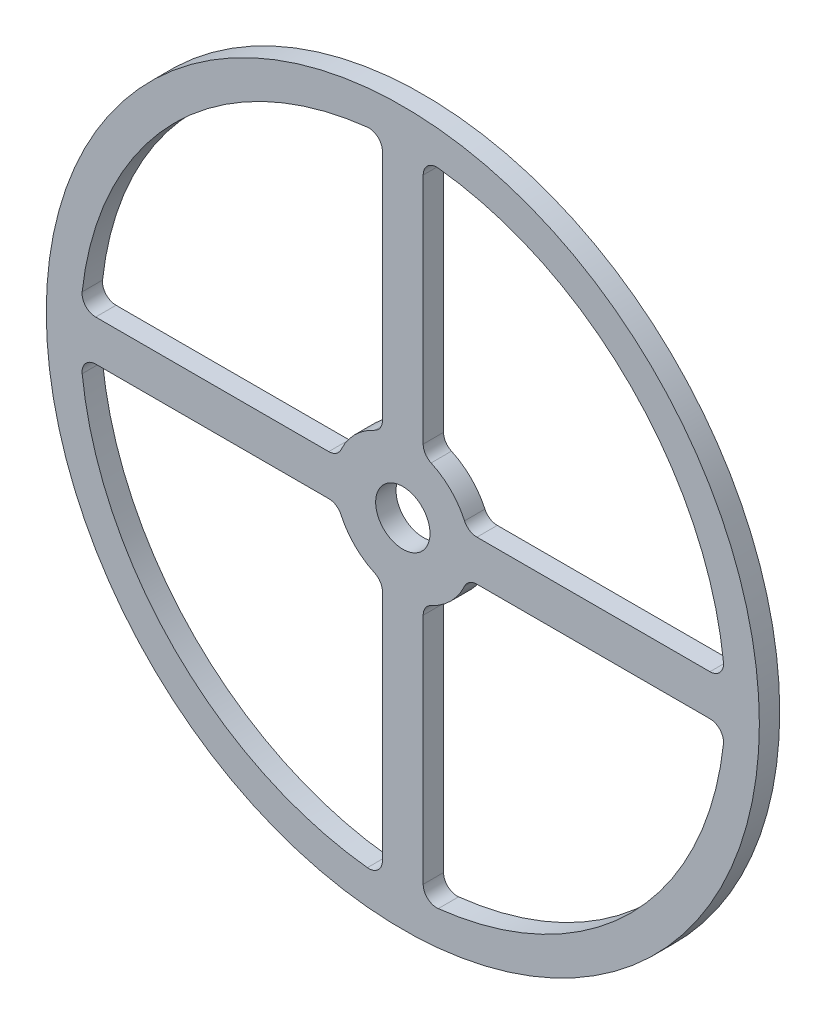
from build123d import *

# Parameters (mm, degrees)
SKETCH_1_R      = 52.5
SKETCH_1_R_2    = 4
EXTRUDE_1_DEPTH = 3
FILLET_1_R      = 2


with BuildPart() as part:
    # 草图1 → 凸台-拉伸1 (new body)
    with BuildSketch(Plane.XY):
        Circle(SKETCH_1_R)
        Circle(SKETCH_1_R_2, mode=Mode.SUBTRACT)
        with BuildLine():
            Line((3, 47.405168495), (3, 9.539392014))
            ThreePointArc((3, 9.539392014), (7.071067812, 7.071067812), (9.539392014, 3))
            Line((9.539392014, 3), (47.405168495, 3))
            ThreePointArc((47.405168495, 3), (33.587572106, 33.587572106), (3, 47.405168495))
        make_face(mode=Mode.SUBTRACT)
        with BuildLine():
            Line((3, -9.539392014), (3, -47.405168495))
            ThreePointArc((3, -47.405168495), (33.587572106, -33.587572106), (47.405168495, -3))
            Line((47.405168495, -3), (9.539392014, -3))
            ThreePointArc((9.539392014, -3), (7.071067812, -7.071067812), (3, -9.539392014))
        make_face(mode=Mode.SUBTRACT)
        with BuildLine():
            Line((-3, 47.405168495), (-3, 9.539392014))
            ThreePointArc((-3, 9.539392014), (-7.071067812, 7.071067812), (-9.539392014, 3))
            Line((-9.539392014, 3), (-47.405168495, 3))
            ThreePointArc((-47.405168495, 3), (-33.587572106, 33.587572106), (-3, 47.405168495))
        make_face(mode=Mode.SUBTRACT)
        with BuildLine():
            Line((-47.405168495, -3), (-9.539392014, -3))
            ThreePointArc((-9.539392014, -3), (-7.071067812, -7.071067812), (-3, -9.539392014))
            Line((-3, -9.539392014), (-3, -47.405168495))
            ThreePointArc((-3, -47.405168495), (-33.587572106, -33.587572106), (-47.405168495, -3))
        make_face(mode=Mode.SUBTRACT)
    extrude(amount=EXTRUDE_1_DEPTH)

    # 圆角1
    fillet_1_edges = [part.edges().sort_by_distance(p)[0] for p in [
        (-3, 47.405168495, 1.5),
        (-47.405168495, 3, 1.5),
        (-9.539392014, 3, 1.5),
        (-3, 9.539392014, 1.5),
        (3, -47.405168495, 1.5),
        (47.405168495, -3, 1.5),
        (9.539392014, -3, 1.5),
        (3, -9.539392014, 1.5),
        (-47.405168495, -3, 1.5),
        (-3, -47.405168495, 1.5),
        (-3, -9.539392014, 1.5),
        (-9.539392014, -3, 1.5),
        (3, 9.539392014, 1.5),
        (9.539392014, 3, 1.5),
        (47.405168495, 3, 1.5),
        (3, 47.405168495, 1.5),
    ]]
    fillet(fillet_1_edges, radius=FILLET_1_R)


solid = part.part
